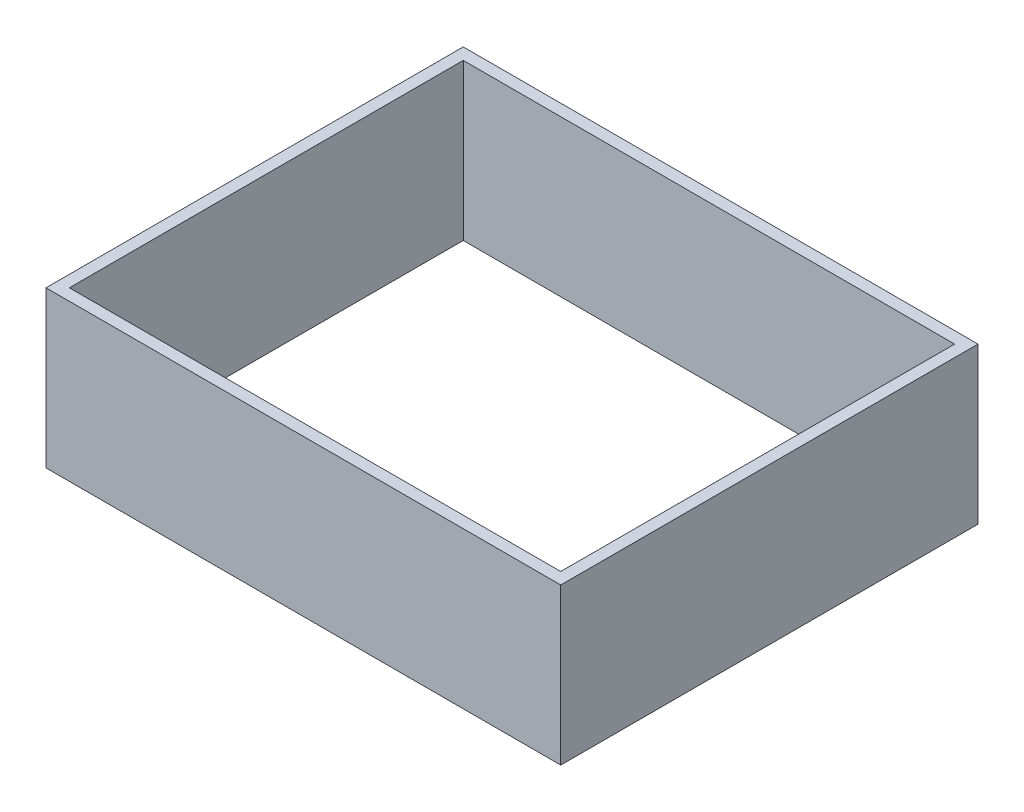
from build123d import *

# Parameters (mm, degrees)
SKETCH_1_W        = 66
SKETCH_1_H        = 20
EXTRUDE_224_DEPTH = 1.5
EXTRUDE_START     = 1.5
SKETCH_2_W        = 1.5
SKETCH_2_H        = 20
EXTRUDE_307_DEPTH = 50.5
EXTRUDE_START_2   = 52
SKETCH_3_W        = 66
SKETCH_3_H        = 20
EXTRUDE_387_DEPTH = 1.5


with BuildPart() as part:
    # 草图1 → Extrude 224 (new body)
    with BuildSketch(Plane.XY):
        Rectangle(SKETCH_1_W, SKETCH_1_H)
    extrude(amount=EXTRUDE_224_DEPTH)

    # 草图2 → Extrude 307 (add)
    with BuildSketch(Plane.XY.offset(EXTRUDE_START)):
        with Locations((-32.25, 0)):
            Rectangle(SKETCH_2_W, SKETCH_2_H)
        with Locations((32.25, 0)):
            Rectangle(SKETCH_2_W, SKETCH_2_H)
    extrude(amount=EXTRUDE_307_DEPTH)

    # 草图3 → Extrude 387 (add)
    with BuildSketch(Plane.XY.offset(EXTRUDE_START_2)):
        Rectangle(SKETCH_3_W, SKETCH_3_H)
    extrude(amount=EXTRUDE_387_DEPTH)


solid = part.part
